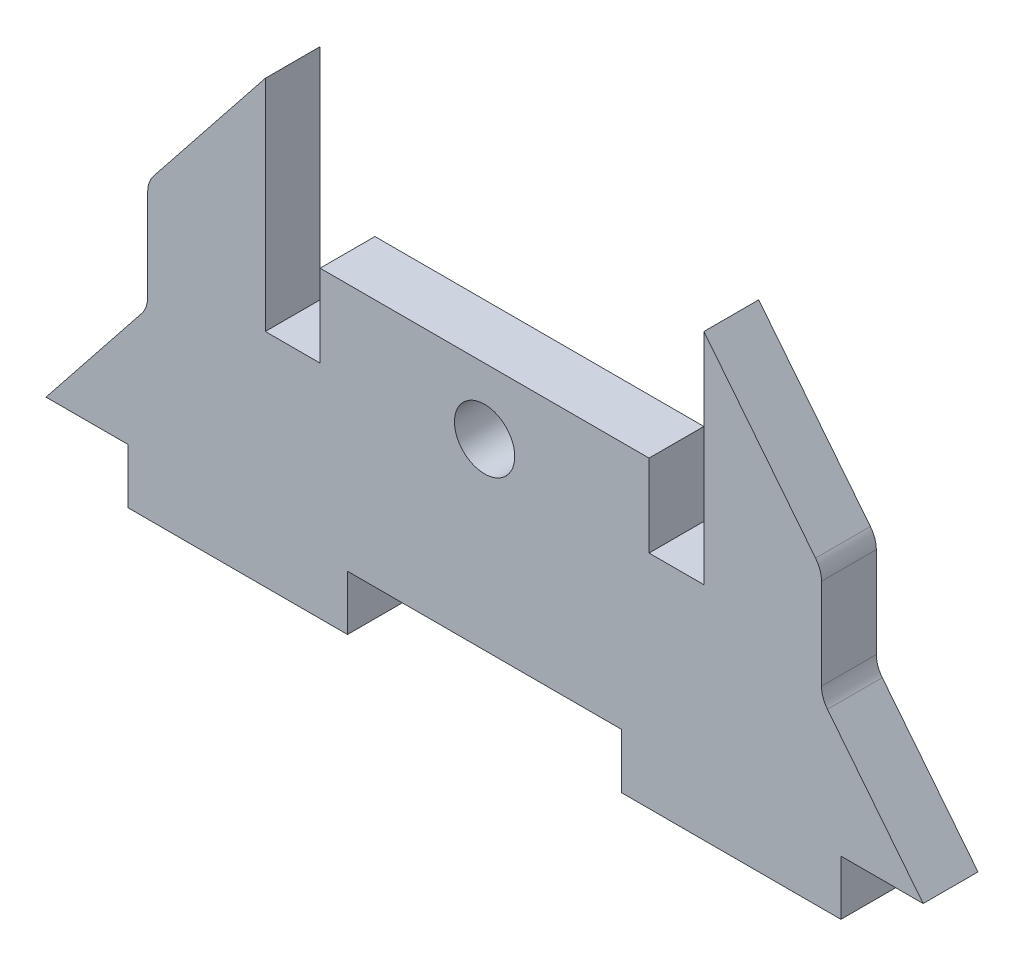
from build123d import *

# Parameters (mm, degrees)
SKETCH1_R           = 1.1
BOSS_EXTRUDE1_DEPTH = 2


with BuildPart() as part:
    # Sketch1 → Boss-Extrude1 (new body)
    with BuildSketch(Plane.XY):
        with BuildLine():
            Line((5, -6.674), (-5, -6.674))
            Line((-5, -6.674), (-5, -8.674))
            Line((-5, -8.674), (-13, -8.674))
            Line((-13, -8.674), (-13, -6.674))
            Line((-13, -6.674), (-16, -6.674))
            Line((-16, -6.674), (-12.508255124, -2.282440657))
            ThreePointArc((-12.508255124, -2.282440657), (-12.346867401, -1.989679888), (-12.290989968, -1.660085322))
            Line((-12.290989968, -1.660085322), (-12.290989968, 1.65413052))
            ThreePointArc((-12.290989968, 1.65413052), (-12.235112536, 1.983725086), (-12.073724813, 2.276485855))
            Line((-12.073724813, 2.276485855), (-8, 7.4))
            Line((-8, 7.4), (-8, 2.4))
            Line((-8, 2.4), (-8, -0.6))
            Line((-8, -0.6), (-6, -0.6))
            Line((-6, -0.6), (-6, 2.4))
            Line((-6, 2.4), (6, 2.4))
            Line((6, 2.4), (6, -0.6))
            Line((6, -0.6), (8, -0.6))
            Line((8, -0.6), (8, 2.4))
            Line((8, 2.4), (8, 7.4))
            Line((8, 7.4), (12.073724813, 2.276485855))
            ThreePointArc((12.073724813, 2.276485855), (12.235112536, 1.983725086), (12.290989968, 1.65413052))
            Line((12.290989968, 1.65413052), (12.290989968, -1.660085322))
            ThreePointArc((12.290989968, -1.660085322), (12.346867401, -1.989679888), (12.508255124, -2.282440657))
            Line((12.508255124, -2.282440657), (16, -6.674))
            Line((16, -6.674), (13, -6.674))
            Line((13, -6.674), (13, -8.674))
            Line((13, -8.674), (5, -8.674))
            Line((5, -8.674), (5, -6.674))
        make_face()
        Circle(SKETCH1_R, mode=Mode.SUBTRACT)
    extrude(amount=BOSS_EXTRUDE1_DEPTH)


solid = part.part
